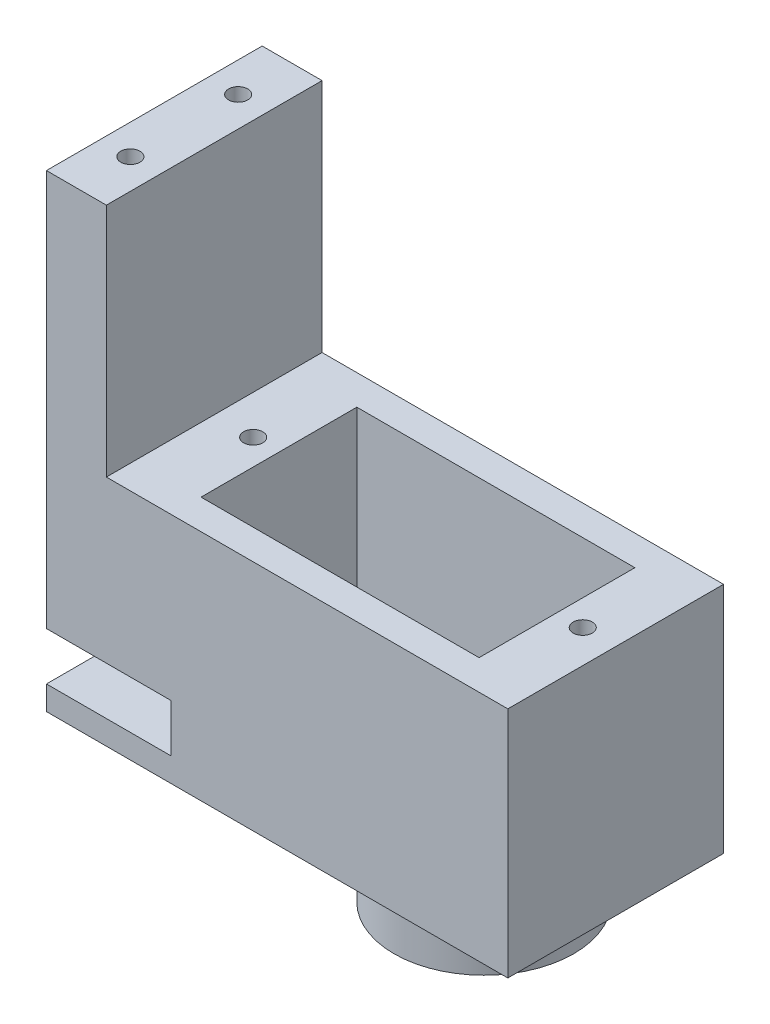
from build123d import *

# Parameters (mm, degrees)
SKETCH1_W               = 38.5
SKETCH1_H               = 19.45
BOSS_EXTRUDE1_DEPTH     = 9
SKETCH2_W               = 5
SKETCH2_H               = 19.65
BOSS_EXTRUDE2_DEPTH     = 9
SKETCH3_R               = 7.5
BOSS_EXTRUDE3_DEPTH     = 4.5
SKETCH4_W               = 23.2
SKETCH4_H               = 13
CUT_EXTRUDE1_DEPTH      = 17.45
SKETCH5_R               = 5
CUT_EXTRUDE3_DEPTH      = 4
CUT_EXTRUDE4_DEPTH      = 35.351710292
CUT_EXTRUDE4_DEPTH_BACK = 35.351710292
SKETCH6_W               = 10.4
SKETCH6_H               = 4
SKETCH7_R               = 0.8
CUT_EXTRUDE5_DEPTH      = 8
SKETCH8_R               = 0.8
CUT_EXTRUDE6_DEPTH      = 8
SKETCH9_R               = 0.8
CUT_EXTRUDE7_DEPTH      = 10
SKETCH10_R              = 0.8
CUT_EXTRUDE8_DEPTH      = 10


with BuildPart() as part:
    # Sketch1 → Boss-Extrude1 (new, symmetric)
    with BuildSketch(Plane.XY):
        with Locations((-2.75, -4.575)):
            Rectangle(SKETCH1_W, SKETCH1_H)
    extrude(amount=BOSS_EXTRUDE1_DEPTH, both=True)

    # Sketch2 → Boss-Extrude2 (add, symmetric)
    with BuildSketch(Plane.XY):
        with Locations((-19.5, 14.975)):
            Rectangle(SKETCH2_W, SKETCH2_H)
    extrude(amount=BOSS_EXTRUDE2_DEPTH, both=True)

    # Sketch3 → Boss-Extrude3 (add)
    with BuildSketch(Plane(origin=(0, -18.8, 0), x_dir=(1, 0, 0), z_dir=(0, 1, 0))):
        with Locations(Location((5.5, 0, 0), (0, 0, 270))):
            Circle(SKETCH3_R)
    extrude(amount=BOSS_EXTRUDE3_DEPTH)

    # Sketch4 → Cut-Extrude1 (cut)
    with BuildSketch(Plane(origin=(0, 5.15, 0), x_dir=(1, 0, 0), z_dir=(0, 1, 0))):
        Rectangle(SKETCH4_W, SKETCH4_H)
    extrude(amount=-CUT_EXTRUDE1_DEPTH, mode=Mode.SUBTRACT)

    # Sketch5 → Cut-Extrude3 (cut)
    with BuildSketch(Plane(origin=(0, -18.8, 0), x_dir=(1, 0, 0), z_dir=(0, 1, 0))):
        with Locations(Location((5.5, 0, 0), (0, 0, 270))):
            Circle(SKETCH5_R)
    extrude(amount=CUT_EXTRUDE3_DEPTH, mode=Mode.SUBTRACT)

    # Sketch6 → Cut-Extrude4 (cut, two sides: drawn at the far end of the back side and taken through both)
    with BuildSketch(Plane.XY.offset(-CUT_EXTRUDE4_DEPTH_BACK)):
        with Locations((-16.8, -10.3)):
            Rectangle(SKETCH6_W, SKETCH6_H)
    extrude(amount=CUT_EXTRUDE4_DEPTH + CUT_EXTRUDE4_DEPTH_BACK, mode=Mode.SUBTRACT)

    # Sketch7 → Cut-Extrude5 (cut)
    with BuildSketch(Plane(origin=(0, 5.15, 0), x_dir=(1, 0, 0), z_dir=(0, 1, 0))):
        with Locations(Location((-13.75, 0, 0), (0, 0, 270))):
            Circle(SKETCH7_R)
    extrude(amount=-CUT_EXTRUDE5_DEPTH, mode=Mode.SUBTRACT)

    # Sketch8 → Cut-Extrude6 (cut)
    with BuildSketch(Plane(origin=(0, 5.15, 0), x_dir=(1, 0, 0), z_dir=(0, 1, 0))):
        with Locations(Location((13.75, 0, 0), (0, 0, 270))):
            Circle(SKETCH8_R)
    extrude(amount=-CUT_EXTRUDE6_DEPTH, mode=Mode.SUBTRACT)

    # Sketch9 → Cut-Extrude7 (cut)
    with BuildSketch(Plane(origin=(0, 24.8, 0), x_dir=(1, 0, 0), z_dir=(0, 1, 0))):
        with Locations(Location((-19.5, -4.5, 0), (0, 0, 270))):
            Circle(SKETCH9_R)
    extrude(amount=-CUT_EXTRUDE7_DEPTH, mode=Mode.SUBTRACT)

    # Sketch10 → Cut-Extrude8 (cut)
    with BuildSketch(Plane(origin=(0, 24.8, 0), x_dir=(1, 0, 0), z_dir=(0, 1, 0))):
        with Locations(Location((-19.5, 4.5, 0), (0, 0, 270))):
            Circle(SKETCH10_R)
    extrude(amount=-CUT_EXTRUDE8_DEPTH, mode=Mode.SUBTRACT)


solid = part.part
